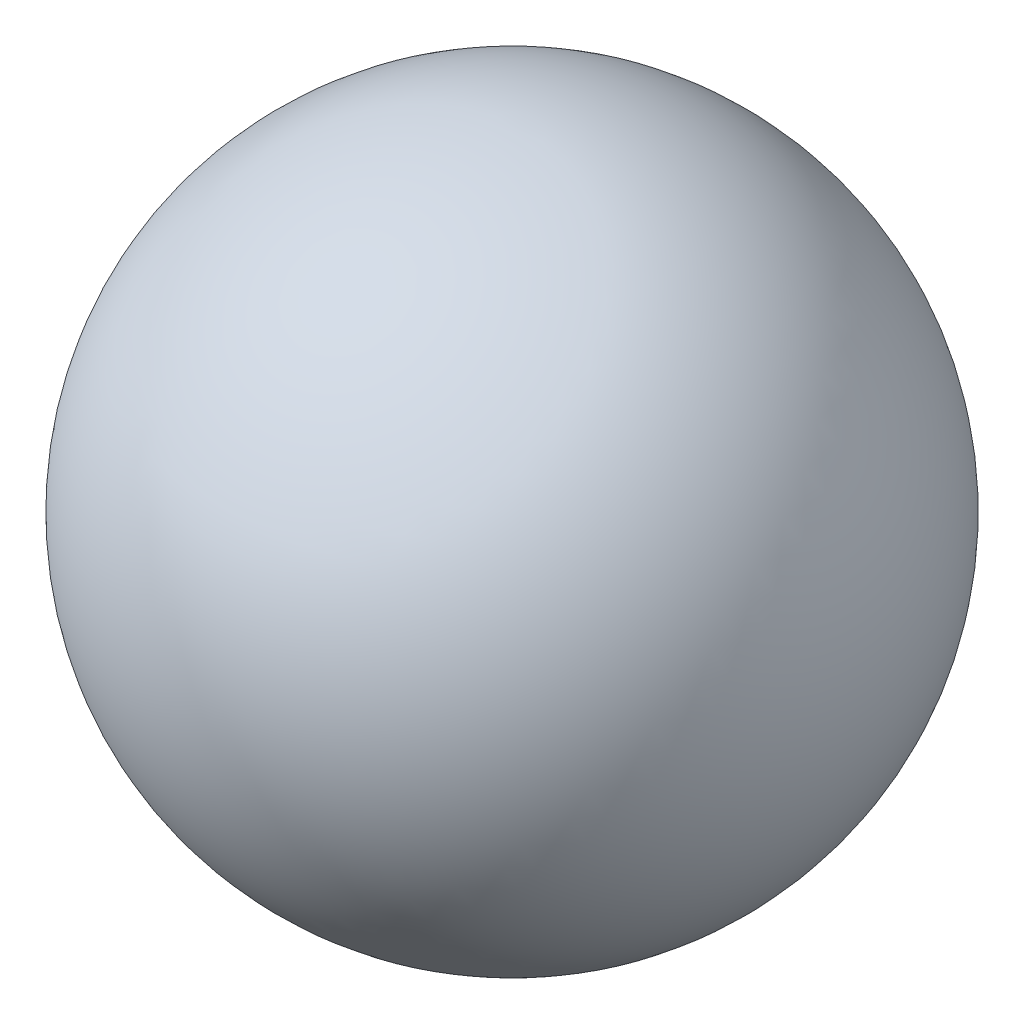
from build123d import *


with BuildPart() as part:
    # 草圖1 → 旋轉1 (revolve)
    with BuildSketch(Plane.XY):
        with BuildLine():
            Line((0, 35), (0, -35))
            ThreePointArc((0, -35), (35, 0), (0, 35))
        make_face()
    revolve(axis=Axis((0, 35, 0), (0, -1, 0)))


solid = part.part
